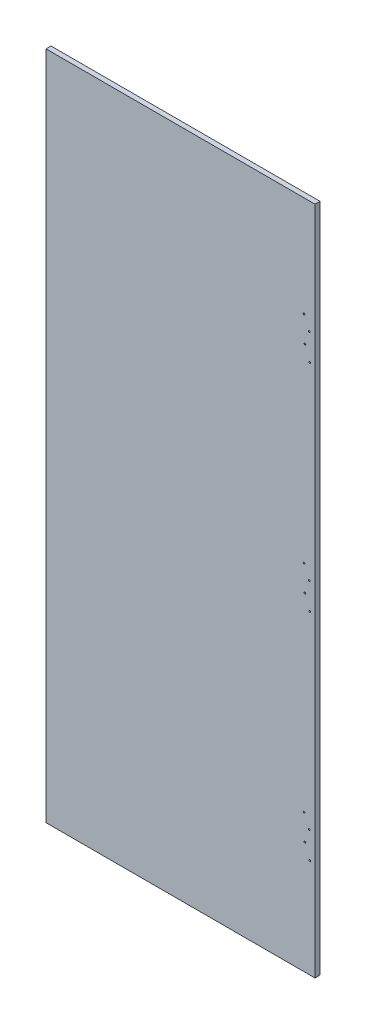
from build123d import *

# Parameters (mm, degrees)
SKETCH1_W           = 810.560523627
SKETCH1_H           = 2019.812900606
BOSS_EXTRUDE1_DEPTH = 15
SKETCH2_R           = 2.64063864
SKETCH2_R_2         = 2.505206938
SKETCH2_R_3         = 2.552698952
SKETCH2_R_4         = 2.552695735
SKETCH2_R_5         = 2.552698993
SKETCH2_R_6         = 2.5527
SKETCH2_R_7         = 2.552586069
SKETCH2_R_8         = 2.552691913
CUT_EXTRUDE1_DEPTH  = 1865.83244333


with BuildPart() as part:
    # Sketch1 → Boss-Extrude1 (new body)
    with BuildSketch(Plane.XY):
        with Locations((-293.803483123, -718.8668024)):
            Rectangle(SKETCH1_W, SKETCH1_H)
    extrude(amount=-BOSS_EXTRUDE1_DEPTH)

    # Sketch2 → Cut-Extrude1 (cut, through all)
    with BuildSketch(Plane.XY):
        with Locations((78.515875942, -12.284076492)):
            Circle(SKETCH2_R)
        with Locations((94.163153701, -49.817072708)):
            Circle(SKETCH2_R_2)
        with Locations((81.198266415, -89.284759451)):
            Circle(SKETCH2_R_3)
        with Locations((95.951414016, -130.300198616)):
            Circle(SKETCH2_R_4)
        with Locations((78.515875942, -662.284076492)):
            Circle(SKETCH2_R_5)
        with Locations((94.163153701, -699.817072708)):
            Circle(SKETCH2_R_6)
        with Locations((81.198266415, -739.284759451)):
            Circle(SKETCH2_R_7)
        with Locations((95.951414016, -780.300198616)):
            Circle(SKETCH2_R_7)
        with Locations((78.515875942, -1312.284076492)):
            Circle(SKETCH2_R_8)
        with Locations((94.163153701, -1349.817072708)):
            Circle(SKETCH2_R_7)
        with Locations((81.198266415, -1389.284759451)):
            Circle(SKETCH2_R_6)
        with Locations((95.951414016, -1430.300198616)):
            Circle(SKETCH2_R_6)
    extrude(amount=-CUT_EXTRUDE1_DEPTH, mode=Mode.SUBTRACT)


solid = part.part
